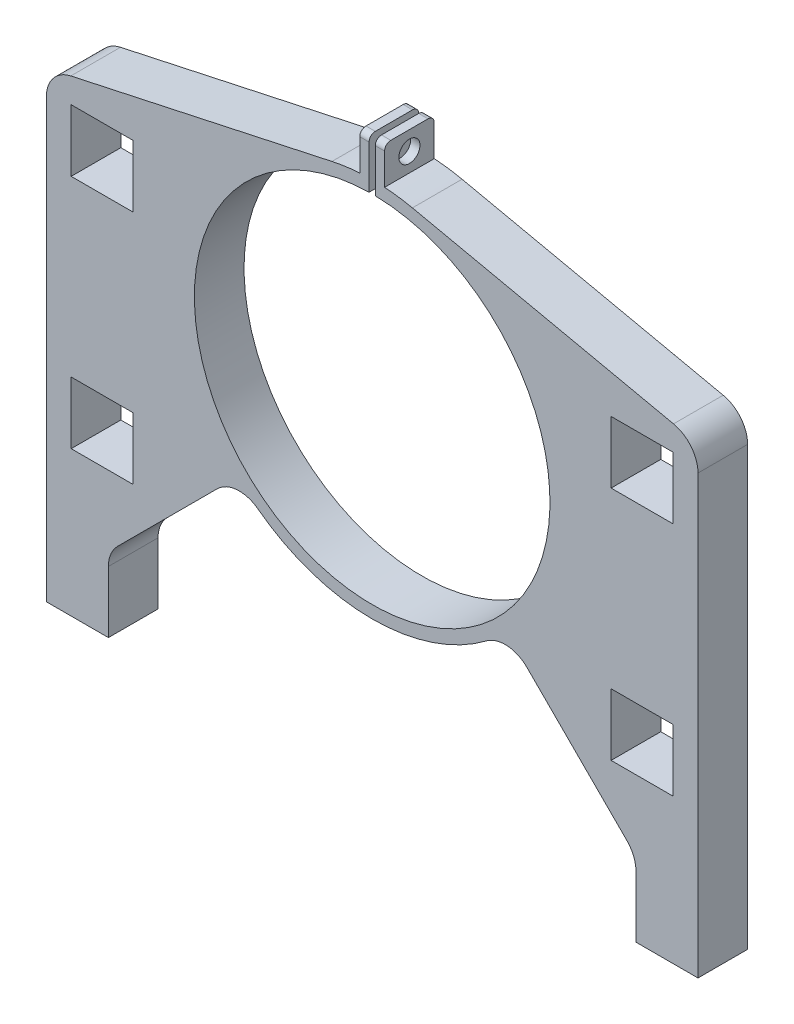
from build123d import *

# Parameters (mm, degrees)
SKIZZE1_R                       = 30.65
SKIZZE1_R_2                     = 28.65
AUFSATZ_LINEAR_AUSTRAGEN1_DEPTH = 8
AUFSATZ_LINEAR_AUSTRAGEN2_DEPTH = 8
SKIZZE3_W                       = 1
SKIZZE3_H                       = 2.855309686
SCHNITT_LINEAR_AUSTRAGEN1_DEPTH = 10
AUFSATZ_LINEAR_AUSTRAGEN3_DEPTH = 8
SKIZZE5_R                       = 1.7
SCHNITT_LINEAR_AUSTRAGEN2_DEPTH = 8
VERRUNDUNG2_R                   = 1
SKIZZE7_W                       = 10
SKIZZE7_H                       = 10
SCHNITT_LINEAR_AUSTRAGEN4_DEPTH = 10
VERRUNDUNG3_R                   = 5


with BuildPart() as part:
    # Skizze1 → Aufsatz-Linear austragen1 (new body)
    with BuildSketch(Plane.XY):
        Circle(SKIZZE1_R)
        Circle(SKIZZE1_R_2, mode=Mode.SUBTRACT)
    extrude(amount=AUFSATZ_LINEAR_AUSTRAGEN1_DEPTH)

    # Skizze2 → Aufsatz-Linear austragen2 (add)
    with BuildSketch(Plane.XY.offset(8)):
        with BuildLine():
            Line((42.5, -42.5), (42.5, -54.5))
            Line((42.5, -54.5), (52.5, -54.5))
            Line((52.5, -54.5), (52.5, 20))
            Line((52.5, 20), (6.481641536, 29.956815969))
            Line((6.481641536, 29.956815969), (6.460494255, 29.859077581))
            ThreePointArc((6.460494255, 29.859077581), (29.307694933, 8.623312455), (21.602112165, -21.602112165))
            Line((21.602112165, -21.602112165), (21.672822843, -21.672822843))
            Line((21.672822843, -21.672822843), (42.5, -42.5))
        make_face()
        with BuildLine():
            Line((-21.672822843, -21.672822843), (-42.5, -42.5))
            Line((-42.5, -42.5), (-42.5, -54.5))
            Line((-42.5, -54.5), (-52.5, -54.5))
            Line((-52.5, -54.5), (-52.5, 20))
            Line((-52.5, 20), (-6.481641536, 29.956815969))
            Line((-6.481641536, 29.956815969), (-6.460494255, 29.859077581))
            ThreePointArc((-6.460494255, 29.859077581), (-29.307694933, 8.623312455), (-21.602112165, -21.602112165))
            Line((-21.602112165, -21.602112165), (-21.672822843, -21.672822843))
        make_face()
    extrude(amount=-AUFSATZ_LINEAR_AUSTRAGEN2_DEPTH)

    # Skizze3 → Schnitt-Linear austragen1 (cut)
    with BuildSketch(Plane.XY.offset(8)):
        with Locations((0, 29.34103969)):
            Rectangle(SKIZZE3_W, SKIZZE3_H)
    extrude(amount=-SCHNITT_LINEAR_AUSTRAGEN1_DEPTH, mode=Mode.SUBTRACT)

    # Skizze4 → Aufsatz-Linear austragen3 (add)
    with BuildSketch(Plane.XY.offset(8)):
        Polygon((0.5, 30.645921425), (0.5, 36.645921425), (2, 36.645921425), (2, 29.02715443), align=None)
        Polygon((-2, 29.02715443), (-0.5, 30.645921425), (-0.5, 36.645921425), (-2, 36.645921425), align=None)
    extrude(amount=-AUFSATZ_LINEAR_AUSTRAGEN3_DEPTH)

    # Skizze5 → Schnitt-Linear austragen2 (cut)
    with BuildSketch(Plane.ZY.offset(2)):
        with Locations(Location((4, 33.615299481, 0), (0, 0, 270))):
            Circle(SKIZZE5_R)
    extrude(amount=-SCHNITT_LINEAR_AUSTRAGEN2_DEPTH, mode=Mode.SUBTRACT)

    # Verrundung2
    verrundung2_edges = [part.edges().sort_by_distance(p)[0] for p in [
        (-1.25, 36.645921425, 8),
        (-1.25, 36.645921425, 0),
        (1.25, 36.645921425, 8),
        (1.25, 36.645921425, 0),
    ]]
    fillet(verrundung2_edges, radius=VERRUNDUNG2_R)

    # Skizze7 → Schnitt-Linear austragen4 (cut)
    with BuildSketch(Plane(origin=(0, 0, 0), x_dir=(-1, 0, 0), z_dir=(0, 0, -1))):
        with Locations((-43.5, 11.86546468)):
            Rectangle(SKIZZE7_W, SKIZZE7_H)
        with Locations((-43.5, -26.13453532)):
            Rectangle(SKIZZE7_W, SKIZZE7_H)
        with Locations((43.5, -26.13453532)):
            Rectangle(SKIZZE7_W, SKIZZE7_H)
        with Locations((43.5, 11.86546468)):
            Rectangle(SKIZZE7_W, SKIZZE7_H)
    extrude(amount=-SCHNITT_LINEAR_AUSTRAGEN4_DEPTH, mode=Mode.SUBTRACT)

    # Verrundung3
    verrundung3_edges = [part.edges().sort_by_distance(p)[0] for p in [
        (-21.672822843, -21.672822843, 4),
        (-42.5, -42.5, 4),
        (-52.5, 20, 4),
        (21.672822843, -21.672822843, 4),
        (42.5, -42.5, 4),
        (52.5, 20, 4),
    ]]
    fillet(verrundung3_edges, radius=VERRUNDUNG3_R)


solid = part.part
